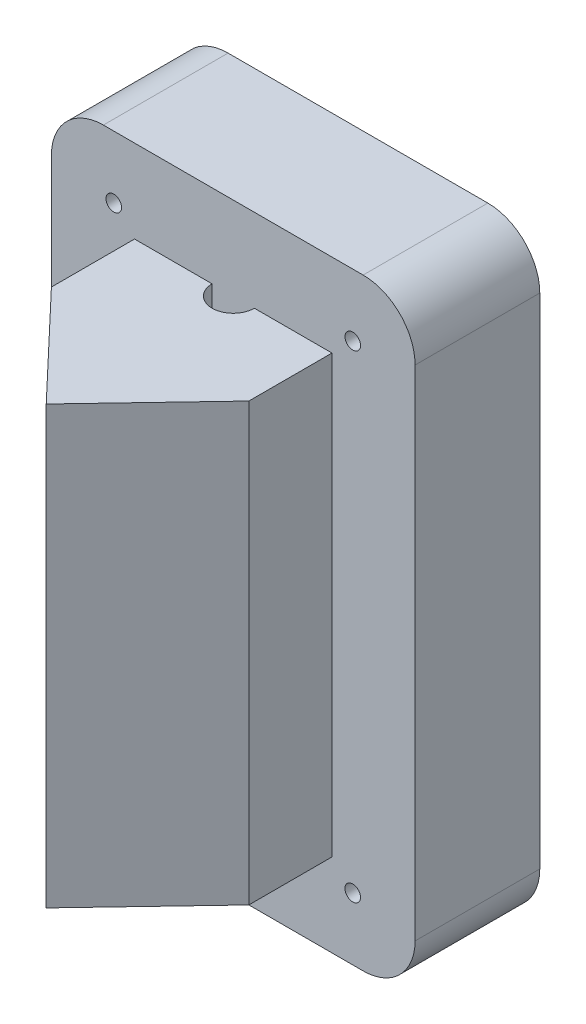
from build123d import *

# Parameters (mm, degrees)
IZIM4_W                     = 175
IZIM4_H                     = 290
Y_KSEKLIK_EKSTR_ZYON5_DEPTH = 60
RADYUS4_R                   = 25
KES_EKSTR_ZYON2_DEPTH       = 344.984011256
KES_EKSTR_ZYON2_DEPTH_BACK  = 344.984011256
IZIM8_R                     = 3.75
IZIM9_W                     = 95
IZIM9_H                     = 210
Y_KSEKLIK_EKSTR_ZYON8_DEPTH = 90
KES_EKSTR_ZYON4_DEPTH       = 341.036762718
KES_EKSTR_ZYON8_DEPTH       = 341.036762718


with BuildPart() as part:
    # Çizim4 → Yükseklik-Ekstrüzyon5 (new body)
    with BuildSketch(Plane.XY):
        with Locations((-87.5, 145)):
            Rectangle(IZIM4_W, IZIM4_H)
    extrude(amount=Y_KSEKLIK_EKSTR_ZYON5_DEPTH)

    # Radyus4
    radyus4_edges = [part.edges().sort_by_distance(p)[0] for p in [
        (0, 0, 30),
        (-175, 0, 30),
        (-175, 290, 30),
        (0, 290, 30),
    ]]
    fillet(radyus4_edges, radius=RADYUS4_R)

    # Çizim8 → Kes-Ekstrüzyon2 (cut, two sides: drawn at the far end of the back side and taken through both)
    with BuildSketch(Plane.XY.offset(60).offset(-KES_EKSTR_ZYON2_DEPTH_BACK)):
        with Locations((-145, 30)):
            Circle(IZIM8_R)
        with Locations((-30, 30)):
            Circle(IZIM8_R)
        with Locations((-145, 260)):
            Circle(IZIM8_R)
        with Locations((-30, 260)):
            Circle(IZIM8_R)
    extrude(amount=KES_EKSTR_ZYON2_DEPTH + KES_EKSTR_ZYON2_DEPTH_BACK, mode=Mode.SUBTRACT)

    # Çizim9 → Yükseklik-Ekstrüzyon8 (add)
    with BuildSketch(Plane.XY.offset(60)):
        with Locations((-87.5, 145)):
            Rectangle(IZIM9_W, IZIM9_H)
    extrude(amount=Y_KSEKLIK_EKSTR_ZYON8_DEPTH)

    # Çizim11 → Kes-Ekstrüzyon4 (cut, through all)
    with BuildSketch(Plane(origin=(0, 250, 0), x_dir=(1, 0, 0), z_dir=(0, 1, 0))):
        Polygon((-40, -100), (-87.5, -150), (-40, -150), align=None)
        Polygon((-87.5, -150), (-135, -100), (-135, -150), align=None)
    extrude(amount=-KES_EKSTR_ZYON4_DEPTH, mode=Mode.SUBTRACT)

    # Çizim16 → Kes-Ekstrüzyon8 (cut, through all)
    with BuildSketch(Plane(origin=(0, 250, 0), x_dir=(1, 0, 0), z_dir=(0, 1, 0))):
        with BuildLine():
            Line((-77.329660293, -60), (-97.670339707, -60))
            ThreePointArc((-97.670339707, -60), (-87.5, -70.170339707), (-77.329660293, -60))
        make_face()
    extrude(amount=-KES_EKSTR_ZYON8_DEPTH, mode=Mode.SUBTRACT)


solid = part.part
